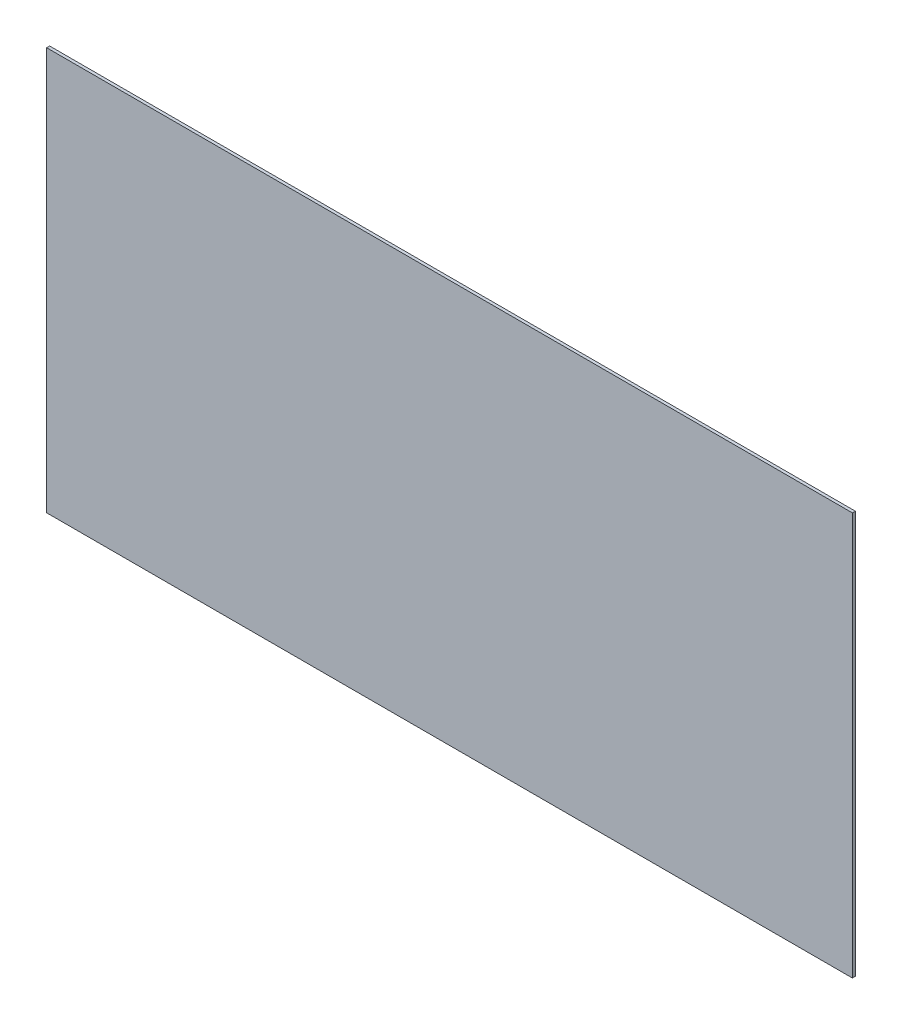
from build123d import *

# Parameters (mm, degrees)
SKETCH1_W           = 20
SKETCH1_H           = 10
BOSS_EXTRUDE1_DEPTH = 0.07366


with BuildPart() as part:
    # Sketch1 → Boss-Extrude1 (new body)
    with BuildSketch(Plane.XY):
        with Locations((10, 0)):
            Rectangle(SKETCH1_W, SKETCH1_H)
    extrude(amount=BOSS_EXTRUDE1_DEPTH)


solid = part.part
